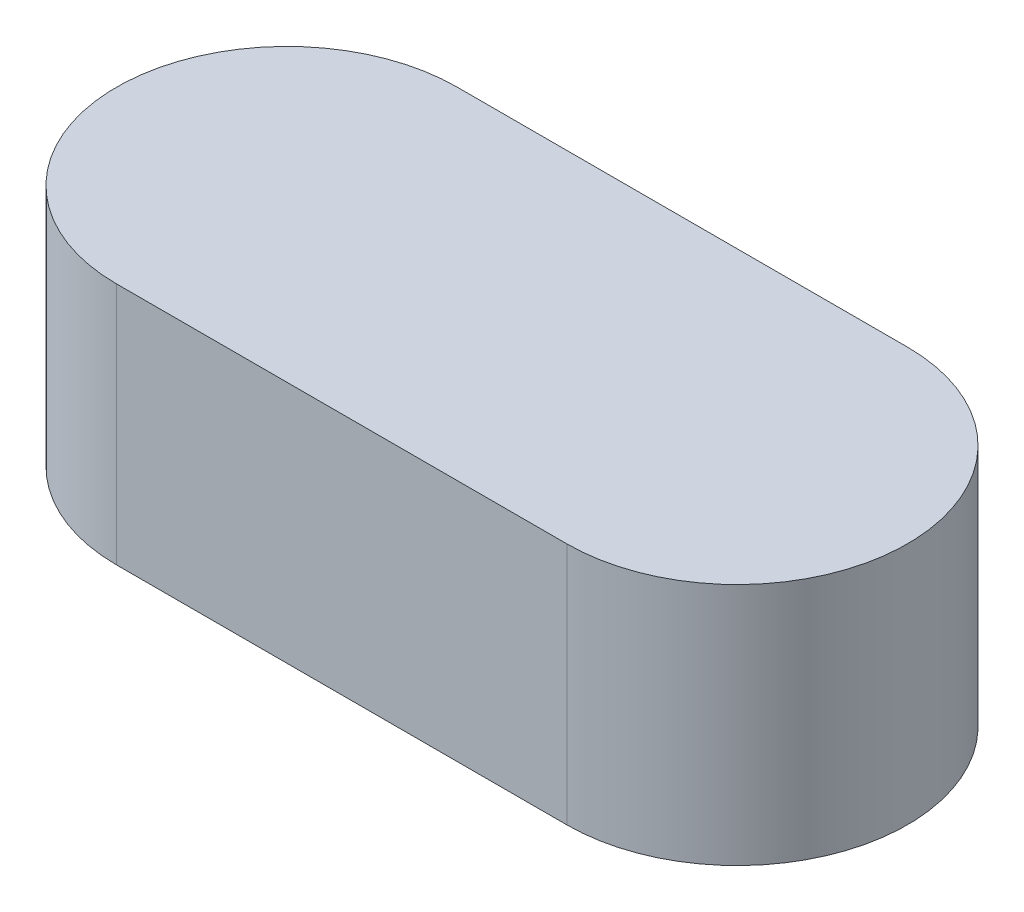
from build123d import *

# Parameters (mm, degrees)
BOSS_EXTRUDE1_DEPTH = 10


with BuildPart() as part:
    # Sketch1 → Boss-Extrude1 (new, symmetric)
    with BuildSketch(Plane(origin=(0, 0, 0), x_dir=(1, 0, 0), z_dir=(0, 1, 0))):
        with BuildLine():
            Line((-18.5, 14), (18.5, 14))
            ThreePointArc((18.5, 14), (32.5, 0), (18.5, -14))
            Line((18.5, -14), (-18.5, -14))
            ThreePointArc((-18.5, -14), (-32.5, 0), (-18.5, 14))
        make_face()
    extrude(amount=BOSS_EXTRUDE1_DEPTH, both=True)


solid = part.part
